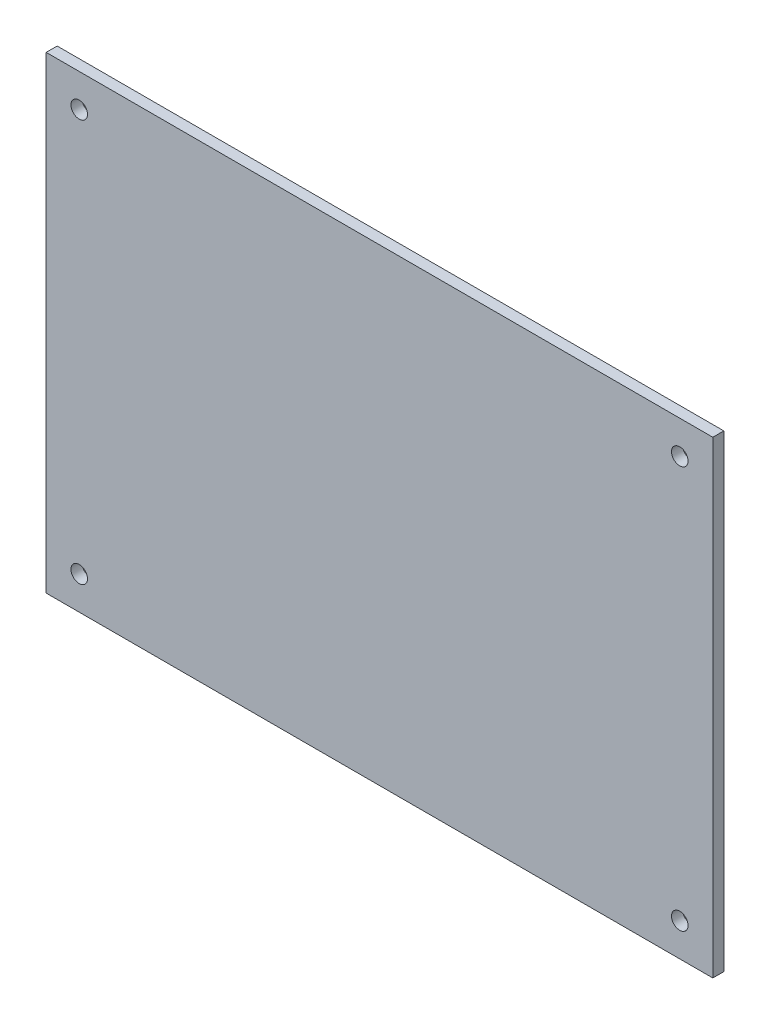
from build123d import *

# Parameters (mm, degrees)
SKETCH1_W           = 121
SKETCH1_H           = 85
BOSS_EXTRUDE1_DEPTH = 2
SKETCH5_R           = 1.5
CUT_EXTRUDE2_DEPTH  = 148.885090526


with BuildPart() as part:
    # Sketch1 → Boss-Extrude1 (new body)
    with BuildSketch(Plane.XY):
        with Locations((60.5, 42.5)):
            Rectangle(SKETCH1_W, SKETCH1_H)
    extrude(amount=BOSS_EXTRUDE1_DEPTH)

    # Sketch5 → Cut-Extrude2 (cut, through all)
    with BuildSketch(Plane.XY.offset(2)):
        with Locations((6, 79)):
            Circle(SKETCH5_R)
        with Locations((115, 79)):
            Circle(SKETCH5_R)
        with Locations((6, 6)):
            Circle(SKETCH5_R)
        with Locations((115, 6)):
            Circle(SKETCH5_R)
    extrude(amount=-CUT_EXTRUDE2_DEPTH, mode=Mode.SUBTRACT)


solid = part.part
